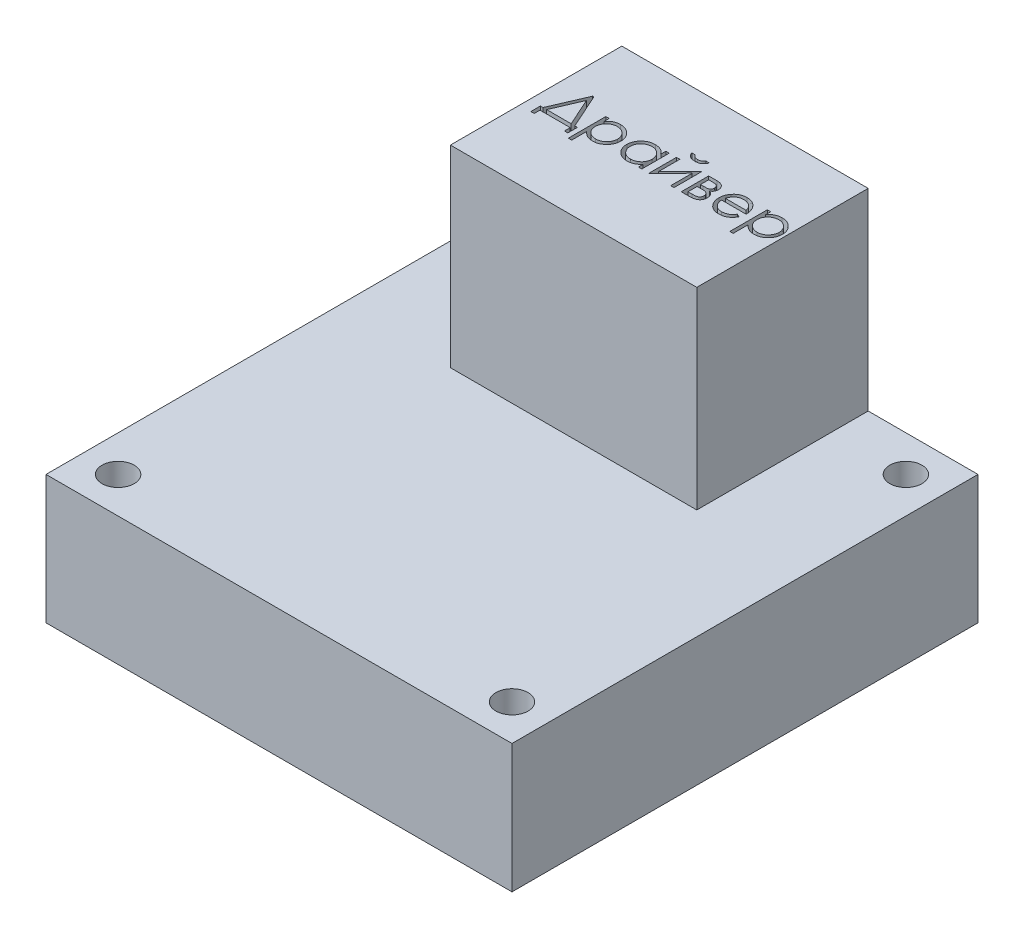
from build123d import *

# Parameters (mm, degrees)
SKETCH_1_W          = 43.5
SKETCH_1_H          = 43.5
SKETCH_1_R          = 1.5
EXTRUDE_1_DEPTH     = 12
EXTRUDE_2_DEPTH     = 18
CUT_EXTRUDE_2_DEPTH = 2


with BuildPart() as part:
    # Эскиз1 → Бобышка-Вытянуть1 (new body)
    with BuildSketch(Plane(origin=(0, 0, 0), x_dir=(1, 0, 0), z_dir=(0, 1, 0))):
        Rectangle(SKETCH_1_W, SKETCH_1_H)
        with Locations(Location((-18.384776311, 18.384776311, 0), (0, 0, 270))):
            Circle(SKETCH_1_R, mode=Mode.SUBTRACT)
        with Locations(Location((18.384776311, -18.384776311, 0), (0, 0, 90))):
            Circle(SKETCH_1_R, mode=Mode.SUBTRACT)
        with Locations(Location((18.384776311, 18.384776311, 0), (0, 0, 270))):
            Circle(SKETCH_1_R, mode=Mode.SUBTRACT)
        with Locations(Location((-18.384776311, -18.384776311, 0), (0, 0, 90))):
            Circle(SKETCH_1_R, mode=Mode.SUBTRACT)
    extrude(amount=EXTRUDE_1_DEPTH)

    # Эскиз2 → Бобышка-Вытянуть2 (add)
    with BuildSketch(Plane(origin=(0, 12, 0), x_dir=(1, 0, 0), z_dir=(0, 1, 0))):
        Polygon((0, 5.75), (-11.5, 5.75), (-11.5, 21.75), (11.5, 21.75), (11.5, 5.75), align=None)
    extrude(amount=EXTRUDE_2_DEPTH)

    # Эскиз3 → Вырез-Вытянуть2 (cut)
    # profile 1 of 8: a face of its own
    with BuildSketch(Plane(origin=(0, 30, 0), x_dir=(1, 0, 0), z_dir=(0, 1, 0))):
        Polygon((-10.14319672, 12.212490373), (-10.457299284, 12.212490373), (-10.457299284, 13.10992627), (-10.210504412, 13.10992627), (-8.815973162, 16.340695501), (-8.695380214, 16.340695501), (-7.248965951, 13.10992627), (-7.002171079, 13.10992627), (-7.002171079, 12.212490373), (-7.316273643, 12.212490373), (-7.316273643, 12.750951911), (-10.14319672, 12.750951911), align=None)
        Polygon((-9.873264829, 13.10992627), (-7.5883089, 13.10992627), (-8.752171079, 15.708984764), align=None, mode=Mode.SUBTRACT)
    # profile 2 of 8: a face of its own
    with BuildSketch(Plane(origin=(0, 30, 0), x_dir=(1, 0, 0), z_dir=(0, 1, 0))):
        with BuildLine():
            Line((-6.55345313, 15.308644219), (-6.239350566, 15.308644219))
            Line((-6.239350566, 15.308644219), (-6.239350566, 14.835387007))
            add(Edge.make_bspline(
                [(-6.239350566, 14.835387007), (-6.205993082, 14.878324741), (-6.141169487, 14.961765634), (-6.029444583, 15.069755763), (-5.911517774, 15.160831066), (-5.784354361, 15.232213599), (-5.649930671, 15.286034411), (-5.508798354, 15.325813861), (-5.359759589, 15.349255336), (-5.257863136, 15.352076997), (-5.205897041, 15.353516014)],
                knots=[0, 0, 0, 0, 1.0828784, 2.104357462, 3.088488658, 4.04616522, 5.001424249, 5.969181776, 6.964304535, 8, 8, 8, 8], degree=3))
            add(Edge.make_bspline(
                [(-5.205897041, 15.353516014), (-5.160505437, 15.352202835), (-5.070786549, 15.349607268), (-4.93872332, 15.332034213), (-4.811547937, 15.301916521), (-4.689979883, 15.258515605), (-4.572716817, 15.204860135), (-4.461494718, 15.1371431), (-4.354581162, 15.058736909), (-4.254664973, 14.968504758), (-4.162343605, 14.870876492), (-4.082497424, 14.765854188), (-4.01362552, 14.656891601), (-3.957955223, 14.542299509), (-3.914346876, 14.422980279), (-3.883332198, 14.298451838), (-3.864874555, 14.169175898), (-3.862398103, 14.081273177), (-3.861145438, 14.036809283)],
                knots=[0, 0, 0, 0, 1.041296284, 2.058176809, 3.050446431, 4.034000596, 5.01514041, 6.003636468, 7.015969324, 8.052561599, 9.08815499, 10.094063707, 11.074456064, 12.040834395, 13.011057502, 13.983766392, 14.980127149, 16, 16, 16, 16], degree=3))
            add(Edge.make_bspline(
                [(-3.861145438, 14.036809283), (-3.862370924, 13.991406974), (-3.864787758, 13.90186707), (-3.883532764, 13.770379973), (-3.913489638, 13.643892599), (-3.956547821, 13.522615335), (-4.012189309, 13.406631684), (-4.07989387, 13.296025288), (-4.159780337, 13.190831585), (-4.251081465, 13.092478685), (-4.350134401, 13.001879372), (-4.45601189, 12.922641302), (-4.567070816, 12.856099927), (-4.682742983, 12.800516967), (-4.804018621, 12.758624783), (-4.930331899, 12.728406983), (-5.061614046, 12.709772487), (-5.150915198, 12.707320344), (-5.196081335, 12.706080116)],
                knots=[0, 0, 0, 0, 1.038740735, 2.04854663, 3.033179607, 4.009277356, 4.987731542, 5.972001279, 6.972200261, 8.005528982, 9.039189865, 10.040446548, 11.026516639, 11.997840187, 12.972163198, 13.956796175, 14.96660207, 16, 16, 16, 16], degree=3))
            add(Edge.make_bspline(
                [(-5.196081335, 12.706080116), (-5.246908907, 12.707374924), (-5.347308263, 12.709932549), (-5.494105934, 12.735851959), (-5.635382786, 12.774588894), (-5.76957361, 12.831287888), (-5.897741423, 12.903543404), (-6.019161229, 12.99165361), (-6.134477982, 13.095434235), (-6.203886739, 13.174166051), (-6.239350566, 13.214393417)],
                knots=[0, 0, 0, 0, 1.014726462, 2.004382257, 2.969841629, 3.936926163, 4.907207904, 5.903978561, 6.929055279, 8, 8, 8, 8], degree=3))
            Line((-6.239350566, 13.214393417), (-6.239350566, 11.808644219))
            Line((-6.239350566, 11.808644219), (-6.55345313, 11.808644219))
            Line((-6.55345313, 11.808644219), (-6.55345313, 15.308644219))
        make_face()
        with BuildLine():
            add(Edge.make_bspline(
                [(-5.208701528, 15.03941345), (-5.24428109, 15.038773191), (-5.314328078, 15.037512688), (-5.417000297, 15.022538739), (-5.515895725, 15.000800998), (-5.610017676, 14.967889098), (-5.700268293, 14.927490285), (-5.785952457, 14.877008273), (-5.867010025, 14.817356267), (-5.943237055, 14.749676924), (-6.012100349, 14.675102235), (-6.073063277, 14.595514426), (-6.124270582, 14.511014287), (-6.166772602, 14.422388924), (-6.199115885, 14.328943639), (-6.222071605, 14.231210626), (-6.236501957, 14.129082914), (-6.238390895, 14.059526907), (-6.239350566, 14.024189091)],
                knots=[0, 0, 0, 0, 1.05670511, 2.080379991, 3.077984906, 4.06214886, 5.038337365, 6.01289324, 7.01187578, 8.025460281, 9.038092164, 10.024533457, 11.000252242, 11.969694649, 12.940728589, 13.933144304, 14.949937299, 16, 16, 16, 16], degree=3))
            add(Edge.make_bspline(
                [(-6.239350566, 14.024189091), (-6.23775971, 13.977800978), (-6.234643088, 13.886922737), (-6.20930572, 13.754138615), (-6.168070456, 13.628486959), (-6.109541743, 13.511025922), (-6.035594168, 13.403043087), (-5.946496012, 13.306352481), (-5.843053461, 13.22156189), (-5.726986269, 13.150140636), (-5.602564139, 13.09215257), (-5.472778226, 13.050638359), (-5.339413346, 13.025066131), (-5.249245026, 13.021819312), (-5.203793675, 13.02018268)],
                knots=[0, 0, 0, 0, 1.03728447, 2.032128127, 3.01272805, 3.987917167, 4.958271349, 5.931593992, 6.91984656, 7.941419022, 8.973179163, 9.983609215, 10.983593296, 12, 12, 12, 12], degree=3))
            add(Edge.make_bspline(
                [(-5.203793675, 13.02018268), (-5.159257907, 13.021739057), (-5.070862414, 13.024828185), (-4.940704293, 13.051566373), (-4.814213654, 13.092411398), (-4.694033482, 13.151970954), (-4.581209994, 13.224961012), (-4.479328441, 13.312521045), (-4.390321527, 13.414010988), (-4.314457172, 13.527019491), (-4.253325687, 13.648194875), (-4.207395447, 13.773576264), (-4.180886873, 13.902721687), (-4.177130085, 13.9897194), (-4.175248002, 14.033303674)],
                knots=[0, 0, 0, 0, 1.00104056, 1.986885549, 2.97790532, 3.984399681, 4.995088187, 5.994304198, 6.996462723, 8.023150851, 9.048424203, 10.043036403, 11.019596776, 12, 12, 12, 12], degree=3))
            add(Edge.make_bspline(
                [(-4.175248002, 14.033303674), (-4.176702736, 14.077158663), (-4.17960087, 14.164526967), (-4.208147907, 14.29328987), (-4.251047885, 14.419177846), (-4.313606937, 14.538698395), (-4.387808207, 14.651472478), (-4.477555204, 14.751026357), (-4.5781714, 14.83819703), (-4.690860564, 14.91021244), (-4.811800989, 14.967497935), (-4.939115905, 15.009381574), (-5.072159508, 15.034555323), (-5.162787162, 15.037779829), (-5.208701528, 15.03941345)],
                knots=[0, 0, 0, 0, 0.983928682, 1.960191568, 2.949917689, 3.96440592, 4.982380491, 5.975291189, 6.965713506, 7.964880129, 8.970154049, 9.96478489, 10.968906225, 12, 12, 12, 12], degree=3))
        make_face(mode=Mode.SUBTRACT)
    # profile 3 of 8: a face of its own
    with BuildSketch(Plane(origin=(0, 30, 0), x_dir=(1, 0, 0), z_dir=(0, 1, 0))):
        with BuildLine():
            Line((-0.630376207, 15.308644219), (-0.630376207, 12.750951911))
            Line((-0.630376207, 12.750951911), (-0.944478771, 12.750951911))
            Line((-0.944478771, 12.750951911), (-0.944478771, 13.193359764))
            add(Edge.make_bspline(
                [(-0.944478771, 13.193359764), (-0.979897562, 13.15332017), (-1.049017777, 13.075182399), (-1.164458895, 12.973100226), (-1.286827073, 12.888721905), (-1.415528394, 12.820571989), (-1.550446638, 12.769379932), (-1.691282725, 12.732993773), (-1.838094106, 12.709599938), (-1.938346461, 12.707263916), (-1.989150246, 12.706080116)],
                knots=[0, 0, 0, 0, 1.074387032, 2.096679803, 3.090159297, 4.057316773, 5.018401886, 5.985159533, 6.978961417, 8, 8, 8, 8], degree=3))
            add(Edge.make_bspline(
                [(-1.989150246, 12.706080116), (-2.0343182, 12.707306488), (-2.123391404, 12.709724949), (-2.254420482, 12.728487252), (-2.380512731, 12.758617874), (-2.501787304, 12.800518764), (-2.617459449, 12.856099585), (-2.728519546, 12.922640833), (-2.834392238, 13.001881663), (-2.933463777, 13.092469692), (-3.024695777, 13.190864679), (-3.10475705, 13.295810226), (-3.17151013, 13.40685253), (-3.22733021, 13.522585684), (-3.270326555, 13.643900603), (-3.300300189, 13.770377771), (-3.319040636, 13.901867645), (-3.321458096, 13.991407168), (-3.3226839, 14.036809283)],
                knots=[0, 0, 0, 0, 1.033919861, 2.038935746, 3.024066025, 3.998881131, 4.97069526, 5.957263378, 6.95902576, 7.993208707, 9.027059324, 10.027763471, 11.009749337, 11.988697705, 12.965288445, 13.950418724, 14.960734635, 16, 16, 16, 16], degree=3))
            add(Edge.make_bspline(
                [(-3.3226839, 14.036809283), (-3.321430928, 14.081272986), (-3.318953871, 14.16917533), (-3.300500651, 14.298454028), (-3.269469643, 14.422972288), (-3.225921795, 14.542329232), (-3.17007984, 14.656669282), (-3.102151753, 14.766073307), (-3.022132628, 14.870842704), (-2.929880221, 14.968513931), (-2.829945451, 15.058734545), (-2.72303672, 15.137143591), (-2.611813439, 15.20486044), (-2.494550429, 15.258513916), (-2.372983324, 15.30192302), (-2.246029878, 15.331955989), (-2.114218299, 15.34965331), (-2.024727807, 15.352216074), (-1.979334541, 15.353516014)],
                knots=[0, 0, 0, 0, 1.020392517, 2.01726096, 2.990465484, 3.961182959, 4.928053699, 5.906110375, 6.912531644, 7.948652711, 8.985773172, 9.998621852, 10.987621588, 11.969261332, 12.953316658, 13.946091881, 14.958173133, 16, 16, 16, 16], degree=3))
            add(Edge.make_bspline(
                [(-1.979334541, 15.353516014), (-1.927134681, 15.352078262), (-1.824773222, 15.349258899), (-1.675045212, 15.325796172), (-1.533400734, 15.286157705), (-1.398746382, 15.232240207), (-1.271565696, 15.160591478), (-1.153062712, 15.070211517), (-1.041997229, 14.96167033), (-0.977616937, 14.878299885), (-0.944478771, 14.835387007)],
                knots=[0, 0, 0, 0, 1.038897134, 2.037228247, 3.008116434, 3.962042015, 4.918381754, 5.904844433, 6.921570401, 8, 8, 8, 8], degree=3))
            Line((-0.944478771, 14.835387007), (-0.944478771, 15.308644219))
            Line((-0.944478771, 15.308644219), (-0.630376207, 15.308644219))
        make_face()
        with BuildLine():
            add(Edge.make_bspline(
                [(-1.97512781, 15.03941345), (-2.021042148, 15.037779812), (-2.111669748, 15.034555271), (-2.24471375, 15.009381776), (-2.372027164, 14.967497181), (-2.492973238, 14.91021528), (-2.605641455, 14.838186543), (-2.706335125, 14.75106516), (-2.795877827, 14.651228146), (-2.871186091, 14.539126036), (-2.932576588, 14.418947944), (-2.97574362, 14.293323506), (-3.004212867, 14.164518529), (-3.007121388, 14.077155843), (-3.008581335, 14.033303674)],
                knots=[0, 0, 0, 0, 1.031046209, 2.035121221, 3.029706178, 4.034933723, 5.034054252, 6.02443088, 7.017295772, 8.038157696, 9.050218397, 10.03989886, 11.016116709, 12, 12, 12, 12], degree=3))
            add(Edge.make_bspline(
                [(-3.008581335, 14.033303674), (-3.006716442, 13.989713567), (-3.002993965, 13.902704211), (-2.976243271, 13.773723634), (-2.931363397, 13.648069592), (-2.870121335, 13.526808598), (-2.79343471, 13.414224498), (-2.704546057, 13.312484376), (-2.602595776, 13.224994787), (-2.489668269, 13.151757214), (-2.369060299, 13.092594693), (-2.242226367, 13.051429053), (-2.111550729, 13.024851273), (-2.022698395, 13.021746796), (-1.977932297, 13.02018268)],
                knots=[0, 0, 0, 0, 0.979072187, 1.954306742, 2.945804271, 3.96968567, 4.997920485, 5.998718438, 6.996577872, 8.005894225, 9.015743152, 10.005417472, 10.995077863, 12, 12, 12, 12], degree=3))
            add(Edge.make_bspline(
                [(-1.977932297, 13.02018268), (-1.932485794, 13.021842644), (-1.842097208, 13.025144148), (-1.7086585, 13.050425413), (-1.579163537, 13.092194211), (-1.455376309, 13.150093338), (-1.340060177, 13.221850694), (-1.2365623, 13.305857785), (-1.149046331, 13.403560969), (-1.074853722, 13.510937422), (-1.016678305, 13.628649419), (-0.974302246, 13.753983609), (-0.94924834, 13.886944358), (-0.946090611, 13.977808285), (-0.944478771, 14.024189091)],
                knots=[0, 0, 0, 0, 1.01762866, 2.023962475, 3.030623092, 4.058876274, 5.077231937, 6.066672613, 7.034107872, 8.005628644, 8.981990164, 9.965428785, 10.961468474, 12, 12, 12, 12], degree=3))
            add(Edge.make_bspline(
                [(-0.944478771, 14.024189091), (-0.945438428, 14.059526921), (-0.947327335, 14.129082954), (-0.961757905, 14.231210472), (-0.984712831, 14.328944198), (-1.017059001, 14.422386887), (-1.059550285, 14.511021902), (-1.110798051, 14.595485663), (-1.171703501, 14.675338874), (-1.241286197, 14.749481945), (-1.3174514, 14.817108407), (-1.39804594, 14.877472648), (-1.484024687, 14.927061421), (-1.573941724, 14.968102692), (-1.667953059, 15.000761842), (-1.766823679, 15.022549536), (-1.869502665, 15.037509857), (-1.939548721, 15.038772238), (-1.97512781, 15.03941345)],
                knots=[0, 0, 0, 0, 1.050140795, 2.067009409, 3.05949893, 4.030605086, 5.00011959, 5.97591094, 6.962425594, 7.979863591, 8.993523472, 9.986985069, 10.967611495, 11.937549037, 12.921786183, 13.919465291, 14.943216303, 16, 16, 16, 16], degree=3))
        make_face(mode=Mode.SUBTRACT)
    # profile 4 of 8: a face of its own
    with BuildSketch(Plane(origin=(0, 30, 0), x_dir=(1, 0, 0), z_dir=(0, 1, 0))):
        Polygon((0.35680328, 15.308644219), (0.35680328, 13.30133252), (2.331162254, 15.308644219), (2.376034049, 15.308644219), (2.376034049, 12.750951911), (2.061931485, 12.750951911), (2.061931485, 14.758964732), (0.087572511, 12.750951911), (0.042700716, 12.750951911), (0.042700716, 15.308644219), align=None)
    # profile 5 of 8: a face of its own
    with BuildSketch(Plane(origin=(0, 30, 0), x_dir=(1, 0, 0), z_dir=(0, 1, 0))):
        with BuildLine():
            Line((0.401675075, 16.385567296), (0.715777639, 16.385567296))
            add(Edge.make_bspline(
                [(0.715777639, 16.385567296), (0.728726753, 16.364106527), (0.754111593, 16.322035838), (0.80188938, 16.267208517), (0.854957869, 16.219833048), (0.915270938, 16.181877166), (0.981678185, 16.15236519), (1.054065667, 16.131336538), (1.132490947, 16.118539275), (1.186881049, 16.117086803), (1.214976357, 16.116336526)],
                knots=[0, 0, 0, 0, 1.004905616, 1.969970028, 2.907627487, 3.852770604, 4.819066461, 5.816934836, 6.872333649, 8, 8, 8, 8], degree=3))
            add(Edge.make_bspline(
                [(1.214976357, 16.116336526), (1.242821418, 16.116916235), (1.296190926, 16.118027338), (1.371891266, 16.12888393), (1.438960419, 16.148096319), (1.499380492, 16.174168988), (1.553810245, 16.21170857), (1.60630152, 16.258608952), (1.656741383, 16.31735935), (1.687054777, 16.362097661), (1.702957126, 16.385567296)],
                knots=[0, 0, 0, 0, 1.136002968, 2.177331135, 3.11013852, 3.976874704, 4.849833501, 5.795570595, 6.843560474, 8, 8, 8, 8], degree=3))
            Line((1.702957126, 16.385567296), (2.01705969, 16.385567296))
            add(Edge.make_bspline(
                [(2.01705969, 16.385567296), (2.012498431, 16.366772603), (2.003418785, 16.32935988), (1.983621508, 16.274996721), (1.958223227, 16.223368902), (1.928584788, 16.173772821), (1.894202591, 16.126734074), (1.854533696, 16.082120271), (1.80948831, 16.040442397), (1.760619512, 16.000459883), (1.707542017, 15.963415406), (1.648850694, 15.933229529), (1.586996601, 15.906097179), (1.520748983, 15.884512786), (1.450628906, 15.867719834), (1.376296503, 15.85609742), (1.298126718, 15.84786926), (1.24444609, 15.847363562), (1.217079722, 15.847105757)],
                knots=[0, 0, 0, 0, 0.886076703, 1.763824698, 2.645421483, 3.519960152, 4.409204541, 5.312216629, 6.252035265, 7.219118115, 8.20564619, 9.212042138, 10.238927625, 11.2992992, 12.401021763, 13.540535618, 14.746165823, 16, 16, 16, 16], degree=3))
            add(Edge.make_bspline(
                [(1.217079722, 15.847105757), (1.189707985, 15.847327109), (1.136249563, 15.847759421), (1.05842045, 15.856433743), (0.984133076, 15.866701657), (0.914063553, 15.884194189), (0.846849017, 15.904593788), (0.784261982, 15.931810979), (0.724423161, 15.961419863), (0.670142444, 15.997691243), (0.619605661, 16.036666165), (0.574070248, 16.078865145), (0.53276704, 16.123427737), (0.496673271, 16.170651871), (0.465262794, 16.220655515), (0.438633847, 16.27285159), (0.417447848, 16.32820709), (0.406971299, 16.366306732), (0.401675075, 16.385567296)],
                knots=[0, 0, 0, 0, 1.240809151, 2.423364578, 3.549395214, 4.639672911, 5.69586197, 6.731580204, 7.732025552, 8.720035502, 9.687061322, 10.624879356, 11.532735944, 12.440282968, 13.316834462, 14.208199093, 15.094188486, 16, 16, 16, 16], degree=3))
        make_face()
    # profile 6 of 8: a face of its own
    with BuildSketch(Plane(origin=(0, 30, 0), x_dir=(1, 0, 0), z_dir=(0, 1, 0))):
        with BuildLine():
            Line((3.805621389, 12.750951911), (3.049110972, 12.750951911))
            Line((3.049110972, 12.750951911), (3.049110972, 15.308644219))
            Line((3.049110972, 15.308644219), (3.804920267, 15.308644219))
            add(Edge.make_bspline(
                [(3.804920267, 15.308644219), (3.839763701, 15.308199295), (3.907009433, 15.307340619), (4.004274319, 15.298148524), (4.09404741, 15.282881836), (4.176215164, 15.262077345), (4.251089165, 15.235670264), (4.317798212, 15.201573749), (4.377952185, 15.162814424), (4.429380155, 15.117016968), (4.474068402, 15.068034784), (4.512850267, 15.016498316), (4.545948626, 14.963340135), (4.572935719, 14.907887919), (4.594022595, 14.850599727), (4.608688449, 14.790859486), (4.618212997, 14.729358514), (4.619151546, 14.687485661), (4.619623793, 14.666416655)],
                knots=[0, 0, 0, 0, 1.427533259, 2.755053401, 3.998924347, 5.155719047, 6.225166228, 7.244553757, 8.219418502, 9.149207081, 10.057588519, 10.932956714, 11.78877387, 12.61974002, 13.455987788, 14.285241231, 15.137191238, 16, 16, 16, 16], degree=3))
            add(Edge.make_bspline(
                [(4.619623793, 14.666416655), (4.618737372, 14.635274694), (4.617020466, 14.574955914), (4.602287175, 14.488384613), (4.577779301, 14.409811528), (4.543817609, 14.338781971), (4.499321124, 14.276119663), (4.445003382, 14.221054462), (4.380621811, 14.174416944), (4.332323226, 14.150633946), (4.307624594, 14.138471943)],
                knots=[0, 0, 0, 0, 1.143619607, 2.215073713, 3.21446326, 4.159201869, 5.095513017, 6.024511439, 6.989786887, 8, 8, 8, 8], degree=3))
            add(Edge.make_bspline(
                [(4.307624594, 14.138471943), (4.342946422, 14.123100623), (4.411594325, 14.093226491), (4.503704488, 14.033165704), (4.58115446, 13.961963161), (4.645393409, 13.881450069), (4.694372256, 13.789590045), (4.729192406, 13.687838848), (4.750596607, 13.575889647), (4.752997437, 13.497979038), (4.754239177, 13.45768268)],
                knots=[0, 0, 0, 0, 1.058611844, 2.057410046, 3.00862282, 3.942616955, 4.877695162, 5.857917905, 6.892087908, 8, 8, 8, 8], degree=3))
            add(Edge.make_bspline(
                [(4.754239177, 13.45768268), (4.753665805, 13.429130168), (4.752551861, 13.37365854), (4.741045394, 13.293049051), (4.72240431, 13.218000705), (4.696051562, 13.148475686), (4.663469614, 13.084157692), (4.621943413, 13.025988695), (4.573397486, 12.973268366), (4.517427909, 12.925834587), (4.453780068, 12.884293591), (4.38244812, 12.848938919), (4.304570441, 12.817681877), (4.21885878, 12.793741798), (4.12623673, 12.773671543), (4.02580061, 12.761247611), (3.918195047, 12.752332833), (3.843970268, 12.75142233), (3.805621389, 12.750951911)],
                knots=[0, 0, 0, 0, 1.015658444, 1.973214352, 2.891148256, 3.762485175, 4.614429414, 5.449889994, 6.297600539, 7.15923545, 8.054386771, 8.995544337, 9.988746144, 11.036494894, 12.158912702, 13.358852524, 14.635428133, 16, 16, 16, 16], degree=3))
        make_face()
        with BuildLine():
            Line((3.363213536, 14.994541655), (3.363213536, 14.231721142))
            Line((3.363213536, 14.231721142), (3.60299719, 14.231721142))
            add(Edge.make_bspline(
                [(3.60299719, 14.231721142), (3.628937486, 14.231999032), (3.678481312, 14.232529778), (3.749321141, 14.232597308), (3.813092421, 14.235351502), (3.869954617, 14.236665785), (3.919663875, 14.240840302), (3.962356234, 14.243463147), (3.997766666, 14.248972852), (4.036053177, 14.254660848), (4.078918378, 14.268766106), (4.127319302, 14.292601567), (4.174051406, 14.324941547), (4.218871131, 14.364093986), (4.257360175, 14.412074572), (4.286455069, 14.468037731), (4.3023798, 14.531875548), (4.304447422, 14.576588628), (4.305521229, 14.599810084)],
                knots=[0, 0, 0, 0, 1.375093464, 2.626315186, 3.75421073, 4.758304564, 5.640011401, 6.398196949, 7.023623816, 7.538869861, 8.447828541, 9.400717731, 10.390263732, 11.45192877, 12.545000885, 13.630889535, 14.769617458, 16, 16, 16, 16], degree=3))
            add(Edge.make_bspline(
                [(4.305521229, 14.599810084), (4.304568037, 14.624232062), (4.302708309, 14.671880658), (4.284612409, 14.739884132), (4.255474978, 14.801982728), (4.214624577, 14.855309174), (4.169133695, 14.901098345), (4.121127773, 14.937545752), (4.071566908, 14.963858795), (4.027231015, 14.975669418), (3.988699871, 14.980996763), (3.953345191, 14.984274253), (3.911534679, 14.987877631), (3.862682554, 14.990820437), (3.807254682, 14.991694762), (3.745093504, 14.993177574), (3.676389708, 14.994940236), (3.628238836, 14.994678738), (3.60299719, 14.994541655)],
                knots=[0, 0, 0, 0, 1.261615659, 2.461480255, 3.613828623, 4.789490851, 5.918432659, 6.946523639, 7.898592427, 8.802419462, 9.303604123, 9.911379798, 10.639606549, 11.475575686, 12.443493058, 13.508144457, 14.693719696, 16, 16, 16, 16], degree=3))
            Line((3.60299719, 14.994541655), (3.363213536, 14.994541655))
        make_face(mode=Mode.SUBTRACT)
        with BuildLine():
            Line((3.363213536, 13.917618578), (3.363213536, 13.065054475))
            Line((3.363213536, 13.065054475), (3.75514062, 13.065054475))
            add(Edge.make_bspline(
                [(3.75514062, 13.065054475), (3.797915632, 13.065447744), (3.877197599, 13.066176654), (3.986222696, 13.071546612), (4.075751182, 13.07996262), (4.148479856, 13.092737342), (4.209180556, 13.113355226), (4.263333185, 13.141408256), (4.311955633, 13.179810871), (4.357173322, 13.224692786), (4.394299125, 13.278723725), (4.4215538, 13.340174533), (4.436852755, 13.408803155), (4.439014503, 13.456672846), (4.440136613, 13.481520821)],
                knots=[0, 0, 0, 0, 1.675606725, 3.105677622, 4.274449658, 5.197344569, 5.990621431, 6.776893973, 7.573439486, 8.408562431, 9.264355325, 10.125128626, 11.0268005, 12, 12, 12, 12], degree=3))
            add(Edge.make_bspline(
                [(4.440136613, 13.481520821), (4.439814114, 13.497676785), (4.43917991, 13.529447904), (4.431783161, 13.575682513), (4.420889063, 13.619580059), (4.404439048, 13.660735978), (4.383413621, 13.699294055), (4.357755785, 13.735299697), (4.328330774, 13.76933157), (4.281941994, 13.8104639), (4.214880815, 13.854219262), (4.122438961, 13.891927364), (4.018088808, 13.913253732), (3.944775312, 13.916123555), (3.906582927, 13.917618578)],
                knots=[0, 0, 0, 0, 0.749963086, 1.474821674, 2.170122309, 2.847643526, 3.527943615, 4.205812814, 4.898394766, 5.613508977, 7.080247274, 8.594646924, 10.225994407, 12, 12, 12, 12], degree=3))
            Line((3.906582927, 13.917618578), (3.363213536, 13.917618578))
        make_face(mode=Mode.SUBTRACT)
    # profile 7 of 8: a face of its own
    with BuildSketch(Plane(origin=(0, 30, 0), x_dir=(1, 0, 0), z_dir=(0, 1, 0))):
        with BuildLine():
            Line((7.481602959, 13.558644219), (7.760649434, 13.412109764))
            add(Edge.make_bspline(
                [(7.760649434, 13.412109764), (7.738412839, 13.372666432), (7.69514923, 13.29592533), (7.620748482, 13.190493469), (7.54275641, 13.095645753), (7.457652442, 13.013916099), (7.367982763, 12.942664714), (7.273250108, 12.880326889), (7.17296129, 12.827208369), (7.067111565, 12.782455841), (6.954812014, 12.748046347), (6.835790498, 12.723742126), (6.709819002, 12.708718857), (6.623472823, 12.706973717), (6.579259209, 12.706080116)],
                knots=[0, 0, 0, 0, 1.120438281, 2.179929193, 3.190490725, 4.156257408, 5.095198341, 6.022838206, 6.959905092, 7.901321166, 8.864066838, 9.862729781, 10.905609505, 12, 12, 12, 12], degree=3))
            add(Edge.make_bspline(
                [(6.579259209, 12.706080116), (6.530117232, 12.707227292), (6.43425547, 12.709465098), (6.294715723, 12.728757563), (6.163336305, 12.760229921), (6.040124601, 12.804195463), (5.925382349, 12.861622787), (5.818881494, 12.931582269), (5.720061968, 13.013714523), (5.632037759, 13.108730967), (5.552793876, 13.210412924), (5.482868056, 13.316368809), (5.424410625, 13.426332033), (5.376858015, 13.539602557), (5.33845315, 13.655466451), (5.311686446, 13.774977918), (5.296256698, 13.897813503), (5.293892253, 13.980910838), (5.292700716, 14.022786847)],
                knots=[0, 0, 0, 0, 1.145258523, 2.234067595, 3.276747158, 4.290159414, 5.277019952, 6.260822364, 7.254936242, 8.264827045, 9.274100331, 10.257902744, 11.220704747, 12.172965371, 13.118907548, 14.062713208, 15.023725156, 16, 16, 16, 16], degree=3))
            add(Edge.make_bspline(
                [(5.292700716, 14.022786847), (5.293759857, 14.062081677), (5.295858935, 14.139958842), (5.309089723, 14.255224387), (5.332538016, 14.367252839), (5.36471434, 14.476137287), (5.406265586, 14.581695421), (5.457097805, 14.683991485), (5.517290183, 14.782916625), (5.563762857, 14.845319758), (5.58717187, 14.876753193)],
                knots=[0, 0, 0, 0, 1.024358464, 2.0301432, 3.019427413, 4.004406732, 4.986367066, 5.972626655, 6.978780325, 8, 8, 8, 8], degree=3))
            add(Edge.make_bspline(
                [(5.58717187, 14.876753193), (5.618879552, 14.914622063), (5.681290499, 14.989160214), (5.786846854, 15.087098539), (5.901147051, 15.169142315), (6.022758677, 15.237149451), (6.153095151, 15.288823098), (6.290404442, 15.32733068), (6.436250028, 15.348908691), (6.535955249, 15.351956525), (6.586971549, 15.353516014)],
                knots=[0, 0, 0, 0, 1.030682036, 2.02871468, 2.997146059, 3.962720338, 4.930598197, 5.918074684, 6.934738563, 8, 8, 8, 8], degree=3))
            add(Edge.make_bspline(
                [(6.586971549, 15.353516014), (6.639419154, 15.352161965), (6.7423094, 15.349505629), (6.892341521, 15.324879296), (7.034302238, 15.285826741), (7.168134742, 15.230672951), (7.293852603, 15.159513399), (7.410638653, 15.071371558), (7.520490165, 14.96895347), (7.584398744, 14.890190261), (7.616919466, 14.850110565)],
                knots=[0, 0, 0, 0, 1.056321875, 2.072262726, 3.055038591, 4.01806755, 4.982017516, 5.957941055, 6.960871419, 8, 8, 8, 8], degree=3))
            add(Edge.make_bspline(
                [(7.616919466, 14.850110565), (7.639046404, 14.819906984), (7.683152997, 14.759700865), (7.738400097, 14.661529708), (7.786357492, 14.558819113), (7.824690453, 14.449908816), (7.855729955, 14.336089236), (7.878186773, 14.216546691), (7.891356392, 14.09131678), (7.893945089, 14.005990225), (7.895264818, 13.962490373)],
                knots=[0, 0, 0, 0, 0.94817472, 1.890038105, 2.849395472, 3.817997239, 4.812318967, 5.836947057, 6.897266129, 8, 8, 8, 8], degree=3))
            Line((7.895264818, 13.962490373), (5.60680328, 13.962490373))
            add(Edge.make_bspline(
                [(5.60680328, 13.962490373), (5.608342886, 13.928789908), (5.61137046, 13.862519305), (5.625485604, 13.765548522), (5.647734377, 13.673175179), (5.67900344, 13.586092137), (5.716870285, 13.50316201), (5.763256002, 13.424999973), (5.818595556, 13.351962043), (5.880321255, 13.283394905), (5.949028351, 13.222334144), (6.021311098, 13.167682368), (6.098204663, 13.121876771), (6.179102746, 13.084696881), (6.263874531, 13.055590565), (6.352546727, 13.035722745), (6.444944843, 13.022415638), (6.507930577, 13.020935973), (6.539996389, 13.02018268)],
                knots=[0, 0, 0, 0, 1.094153842, 2.151609401, 3.174256925, 4.172055639, 5.149267565, 6.128595816, 7.11444997, 8.118368179, 9.117203808, 10.09244225, 11.054858984, 12.015122123, 12.976791628, 13.957293641, 14.960065497, 16, 16, 16, 16], degree=3))
            add(Edge.make_bspline(
                [(6.539996389, 13.02018268), (6.571347537, 13.020790737), (6.633554227, 13.021997238), (6.726195085, 13.033729149), (6.817334612, 13.052699425), (6.906595595, 13.078589415), (6.992166441, 13.110166267), (7.071411991, 13.148269124), (7.144292207, 13.190418871), (7.212409174, 13.238628546), (7.278480167, 13.297636733), (7.344022653, 13.371272454), (7.414299307, 13.458359982), (7.4582889, 13.523905648), (7.481602959, 13.558644219)],
                knots=[0, 0, 0, 0, 0.99110716, 1.966546729, 2.947904876, 3.932708344, 4.903319531, 5.828989031, 6.710028674, 7.56322171, 8.463672341, 9.504779593, 10.677557249, 12, 12, 12, 12], degree=3))
        make_face()
        with BuildLine():
            add(Edge.make_bspline(
                [(7.581162254, 14.276592937), (7.56966563, 14.31825581), (7.547538328, 14.398443431), (7.501301964, 14.509484321), (7.449230423, 14.608172222), (7.387608692, 14.693751855), (7.317789966, 14.769755368), (7.237144783, 14.836173954), (7.14670889, 14.895591405), (7.046949749, 14.945743904), (6.941307964, 14.988433763), (6.830701772, 15.017058879), (6.717843984, 15.036668421), (6.641509698, 15.038494529), (6.60309735, 15.03941345)],
                knots=[0, 0, 0, 0, 1.154881502, 2.222775134, 3.210006277, 4.132804581, 5.035138423, 5.962687519, 6.919655026, 7.923214229, 8.944639381, 9.960483929, 10.97369054, 12, 12, 12, 12], degree=3))
            add(Edge.make_bspline(
                [(6.60309735, 15.03941345), (6.571747912, 15.038801778), (6.509776663, 15.037592632), (6.418475595, 15.026122503), (6.330795896, 15.007162658), (6.246090608, 14.981197701), (6.16546974, 14.946589099), (6.087274972, 14.906005872), (6.013494575, 14.856464288), (5.96735328, 14.818705433), (5.944042863, 14.799629796)],
                knots=[0, 0, 0, 0, 1.04873581, 2.073130211, 3.073294108, 4.04793562, 5.032784715, 6.005352987, 6.992311501, 8, 8, 8, 8], degree=3))
            add(Edge.make_bspline(
                [(5.944042863, 14.799629796), (5.927349581, 14.78453548), (5.893566447, 14.753988264), (5.848425926, 14.701359057), (5.805205453, 14.644607495), (5.7658718, 14.581562371), (5.729794214, 14.512941592), (5.696034237, 14.439323956), (5.665647824, 14.360150826), (5.648551714, 14.304978387), (5.639756004, 14.276592937)],
                knots=[0, 0, 0, 0, 0.879870761, 1.780643979, 2.707998968, 3.669668524, 4.684282772, 5.740141944, 6.837334558, 8, 8, 8, 8], degree=3))
            Line((5.639756004, 14.276592937), (7.581162254, 14.276592937))
        make_face(mode=Mode.SUBTRACT)
    # profile 8 of 8: a face of its own
    with BuildSketch(Plane(origin=(0, 30, 0), x_dir=(1, 0, 0), z_dir=(0, 1, 0))):
        with BuildLine():
            Line((8.523469947, 15.308644219), (8.837572511, 15.308644219))
            Line((8.837572511, 15.308644219), (8.837572511, 14.835387007))
            add(Edge.make_bspline(
                [(8.837572511, 14.835387007), (8.870929995, 14.878324741), (8.935753589, 14.961765634), (9.047478494, 15.069755763), (9.165405303, 15.160831066), (9.292568716, 15.232213599), (9.426992406, 15.286034411), (9.568124723, 15.325813861), (9.717163488, 15.349255336), (9.819059941, 15.352076997), (9.871026036, 15.353516014)],
                knots=[0, 0, 0, 0, 1.0828784, 2.104357462, 3.088488658, 4.04616522, 5.001424249, 5.969181776, 6.964304535, 8, 8, 8, 8], degree=3))
            add(Edge.make_bspline(
                [(9.871026036, 15.353516014), (9.91641764, 15.352202835), (10.006136528, 15.349607268), (10.138199757, 15.332034213), (10.26537514, 15.301916521), (10.386943194, 15.258515605), (10.504206259, 15.204860135), (10.615428359, 15.1371431), (10.722341915, 15.058736909), (10.822258104, 14.968504758), (10.914579472, 14.870876492), (10.994425653, 14.765854188), (11.063297557, 14.656891601), (11.118967853, 14.542299509), (11.162576201, 14.422980279), (11.193590879, 14.298451838), (11.212048522, 14.169175898), (11.214524974, 14.081273177), (11.215777639, 14.036809283)],
                knots=[0, 0, 0, 0, 1.041296284, 2.058176809, 3.050446431, 4.034000596, 5.01514041, 6.003636468, 7.015969324, 8.052561599, 9.08815499, 10.094063707, 11.074456064, 12.040834395, 13.011057502, 13.983766392, 14.980127149, 16, 16, 16, 16], degree=3))
            add(Edge.make_bspline(
                [(11.215777639, 14.036809283), (11.214552153, 13.991406974), (11.212135319, 13.90186707), (11.193390313, 13.770379973), (11.163433439, 13.643892599), (11.120375256, 13.522615335), (11.064733767, 13.406631684), (10.997029207, 13.296025288), (10.91714274, 13.190831585), (10.825841612, 13.092478685), (10.726788676, 13.001879372), (10.620911187, 12.922641302), (10.509852261, 12.856099927), (10.394180094, 12.800516967), (10.272904456, 12.758624783), (10.146591178, 12.728406983), (10.015309031, 12.709772487), (9.926007879, 12.707320344), (9.880841742, 12.706080116)],
                knots=[0, 0, 0, 0, 1.038740735, 2.04854663, 3.033179607, 4.009277356, 4.987731542, 5.972001279, 6.972200261, 8.005528982, 9.039189865, 10.040446548, 11.026516639, 11.997840187, 12.972163198, 13.956796175, 14.96660207, 16, 16, 16, 16], degree=3))
            add(Edge.make_bspline(
                [(9.880841742, 12.706080116), (9.83001417, 12.707374924), (9.729614813, 12.709932549), (9.582817143, 12.735851959), (9.441540291, 12.774588894), (9.307349466, 12.831287888), (9.179181654, 12.903543404), (9.057761848, 12.99165361), (8.942445095, 13.095434235), (8.873036338, 13.174166051), (8.837572511, 13.214393417)],
                knots=[0, 0, 0, 0, 1.014726462, 2.004382257, 2.969841629, 3.936926163, 4.907207904, 5.903978561, 6.929055279, 8, 8, 8, 8], degree=3))
            Line((8.837572511, 13.214393417), (8.837572511, 11.808644219))
            Line((8.837572511, 11.808644219), (8.523469947, 11.808644219))
            Line((8.523469947, 11.808644219), (8.523469947, 15.308644219))
        make_face()
        with BuildLine():
            add(Edge.make_bspline(
                [(9.868221549, 15.03941345), (9.832641987, 15.038773191), (9.762594999, 15.037512688), (9.65992278, 15.022538739), (9.561027352, 15.000800998), (9.466905401, 14.967889098), (9.376654784, 14.927490285), (9.29097062, 14.877008273), (9.209913052, 14.817356267), (9.133686022, 14.749676924), (9.064822728, 14.675102235), (9.0038598, 14.595514426), (8.952652495, 14.511014287), (8.910150475, 14.422388924), (8.877807192, 14.328943639), (8.854851472, 14.231210626), (8.84042112, 14.129082914), (8.838532182, 14.059526907), (8.837572511, 14.024189091)],
                knots=[0, 0, 0, 0, 1.05670511, 2.080379991, 3.077984906, 4.06214886, 5.038337365, 6.01289324, 7.01187578, 8.025460281, 9.038092164, 10.024533457, 11.000252242, 11.969694649, 12.940728589, 13.933144304, 14.949937299, 16, 16, 16, 16], degree=3))
            add(Edge.make_bspline(
                [(8.837572511, 14.024189091), (8.839163367, 13.977800978), (8.842279989, 13.886922737), (8.867617357, 13.754138615), (8.908852621, 13.628486959), (8.967381334, 13.511025922), (9.041328909, 13.403043087), (9.130427065, 13.306352481), (9.233869616, 13.22156189), (9.349936808, 13.150140636), (9.474358938, 13.09215257), (9.60414485, 13.050638359), (9.737509731, 13.025066131), (9.827678051, 13.021819312), (9.873129402, 13.02018268)],
                knots=[0, 0, 0, 0, 1.03728447, 2.032128127, 3.01272805, 3.987917167, 4.958271349, 5.931593992, 6.91984656, 7.941419022, 8.973179163, 9.983609215, 10.983593296, 12, 12, 12, 12], degree=3))
            add(Edge.make_bspline(
                [(9.873129402, 13.02018268), (9.91766517, 13.021739057), (10.006060663, 13.024828185), (10.136218784, 13.051566373), (10.262709423, 13.092411398), (10.382889595, 13.151970954), (10.495713083, 13.224961012), (10.597594636, 13.312521045), (10.68660155, 13.414010988), (10.762465905, 13.527019491), (10.82359739, 13.648194875), (10.86952763, 13.773576264), (10.896036203, 13.902721687), (10.899792992, 13.9897194), (10.901675075, 14.033303674)],
                knots=[0, 0, 0, 0, 1.00104056, 1.986885549, 2.97790532, 3.984399681, 4.995088187, 5.994304198, 6.996462723, 8.023150851, 9.048424203, 10.043036403, 11.019596776, 12, 12, 12, 12], degree=3))
            add(Edge.make_bspline(
                [(10.901675075, 14.033303674), (10.900220341, 14.077158663), (10.897322207, 14.164526967), (10.868775169, 14.29328987), (10.825875192, 14.419177846), (10.76331614, 14.538698395), (10.68911487, 14.651472478), (10.599367873, 14.751026357), (10.498751677, 14.83819703), (10.386062513, 14.91021244), (10.265122088, 14.967497935), (10.137807172, 15.009381574), (10.004763569, 15.034555323), (9.914135915, 15.037779829), (9.868221549, 15.03941345)],
                knots=[0, 0, 0, 0, 0.983928682, 1.960191568, 2.949917689, 3.96440592, 4.982380491, 5.975291189, 6.965713506, 7.964880129, 8.970154049, 9.96478489, 10.968906225, 12, 12, 12, 12], degree=3))
        make_face(mode=Mode.SUBTRACT)
    extrude(amount=-CUT_EXTRUDE_2_DEPTH, mode=Mode.SUBTRACT)


solid = part.part
